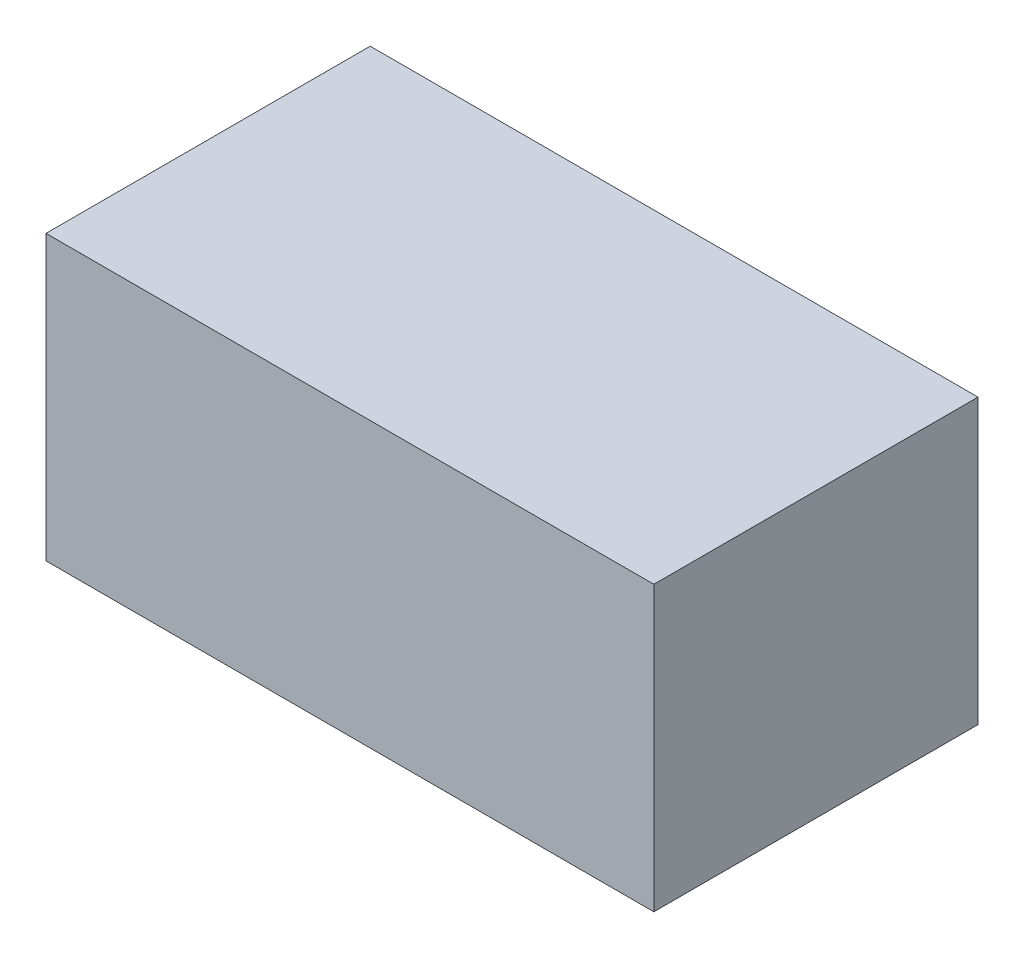
from build123d import *

# Parameters (mm, degrees)
SKETCH1_W           = 4572
SKETCH1_H           = 2438.4
BOSS_EXTRUDE1_DEPTH = 2133.6


with BuildPart() as part:
    # Sketch1 → Boss-Extrude1 (new body)
    with BuildSketch(Plane(origin=(0, 0, 0), x_dir=(1, 0, 0), z_dir=(0, 1, 0))):
        with Locations((220.966608084, -279.087521968)):
            Rectangle(SKETCH1_W, SKETCH1_H)
    extrude(amount=BOSS_EXTRUDE1_DEPTH)


solid = part.part
